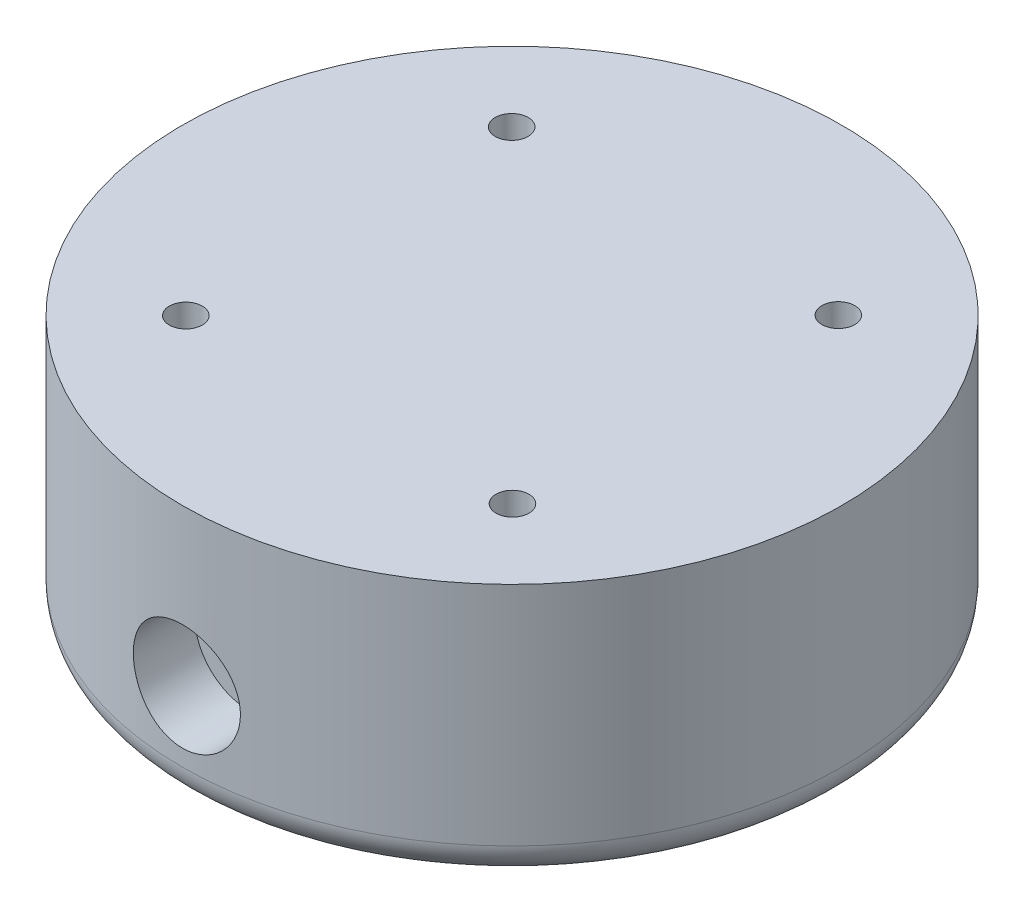
from build123d import *

# Parameters (mm, degrees)
SKETCH1_R               = 40
BOSS_EXTRUDE1_DEPTH     = 31.5
CUT_EXTRUDE1_DEPTH      = 65.747586828
CUT_EXTRUDE1_DEPTH_BACK = 65.747586828
SKETCH2_R               = 3
SKETCH7_R               = 10
CUT_EXTRUDE3_DEPTH      = 21
SKETCH8_R               = 6.5
CUT_EXTRUDE4_DEPTH      = 8
SKETCH9_R               = 7.5
CUT_EXTRUDE5_DEPTH      = 6
SKETCH10_R              = 2
CUT_EXTRUDE7_DEPTH      = 65.747587
CIRPATTERN1_COUNT       = 4
SKETCH12_R              = 4
CUT_EXTRUDE8_DEPTH      = 4
CIRPATTERN2_COUNT       = 4
FILLET1_R               = 4


with BuildPart() as part:
    # Sketch1 → Boss-Extrude1 (new body)
    with BuildSketch(Plane(origin=(0, 0, 0), x_dir=(1, 0, 0), z_dir=(0, 1, 0))):
        with Locations(Location((0, 0, 0), (0, 0, 270))):
            Circle(SKETCH1_R)
    extrude(amount=BOSS_EXTRUDE1_DEPTH)

    # Sketch2 → Cut-Extrude1 (cut, two sides: drawn at the far end of the back side and taken through both)
    with BuildSketch(Plane.XY.offset(-CUT_EXTRUDE1_DEPTH_BACK)):
        with Locations((0, 12.5)):
            Circle(SKETCH2_R)
    extrude(amount=CUT_EXTRUDE1_DEPTH + CUT_EXTRUDE1_DEPTH_BACK, mode=Mode.SUBTRACT)

    # Sketch7 → Cut-Extrude3 (cut)
    with BuildSketch(Plane.XZ):
        with Locations(Location((0, 0, 0), (0, 0, 270))):
            Circle(SKETCH7_R)
    extrude(amount=-CUT_EXTRUDE3_DEPTH, mode=Mode.SUBTRACT)

    # Sketch8 → Cut-Extrude4 (cut)
    with BuildSketch(Plane.XY.offset(40)):
        with Locations((0, 12.5)):
            Circle(SKETCH8_R)
    extrude(amount=-CUT_EXTRUDE4_DEPTH, mode=Mode.SUBTRACT)

    # Sketch9 → Cut-Extrude5 (cut)
    with BuildSketch(Plane(origin=(0, 0, -40), x_dir=(-1, 0, 0), z_dir=(0, 0, -1))):
        with Locations((0, 12.5)):
            Circle(SKETCH9_R)
    extrude(amount=-CUT_EXTRUDE5_DEPTH, mode=Mode.SUBTRACT)

    # Sketch10 → Cut-Extrude7 (cut, symmetric)
    with BuildSketch(Plane(origin=(0, 31.5, 0), x_dir=(1, 0, 0), z_dir=(0, 1, 0))):
        with Locations(Location((-19.774516002, -19.823894806, 0), (0, 0, 270))):
            Circle(SKETCH10_R)
    cut_extrude7 = extrude(amount=CUT_EXTRUDE7_DEPTH, both=True, mode=Mode.SUBTRACT)

    # CirPattern1: Cut-Extrude7 ×4 about axis
    cirpattern1_axis = Axis((0, 0, 0), (0, 1, 0))
    for i in range(1, CIRPATTERN1_COUNT):
        add(cut_extrude7.rotate(cirpattern1_axis, i * 360 / CIRPATTERN1_COUNT), mode=Mode.SUBTRACT)

    # Sketch12 → Cut-Extrude8 (cut)
    with BuildSketch(Plane(origin=(0, 0, 0), x_dir=(-1, 0, 0), z_dir=(0, -1, 0))):
        with Locations(Location((-19.774516002, 19.823894806, 0), (0, 0, 90))):
            Circle(SKETCH12_R)
    cut_extrude8 = extrude(amount=-CUT_EXTRUDE8_DEPTH, mode=Mode.SUBTRACT)

    # CirPattern2: Cut-Extrude8 ×4 about axis
    cirpattern2_axis = Axis((0, 0, 0), (0, 1, 0))
    for i in range(1, CIRPATTERN2_COUNT):
        add(cut_extrude8.rotate(cirpattern2_axis, i * 360 / CIRPATTERN2_COUNT), mode=Mode.SUBTRACT)

    # Fillet1
    fillet1_edges = [part.edges().sort_by_distance(p)[0] for p in [
        (0, 0, -40),
    ]]
    fillet(fillet1_edges, radius=FILLET1_R)


solid = part.part
